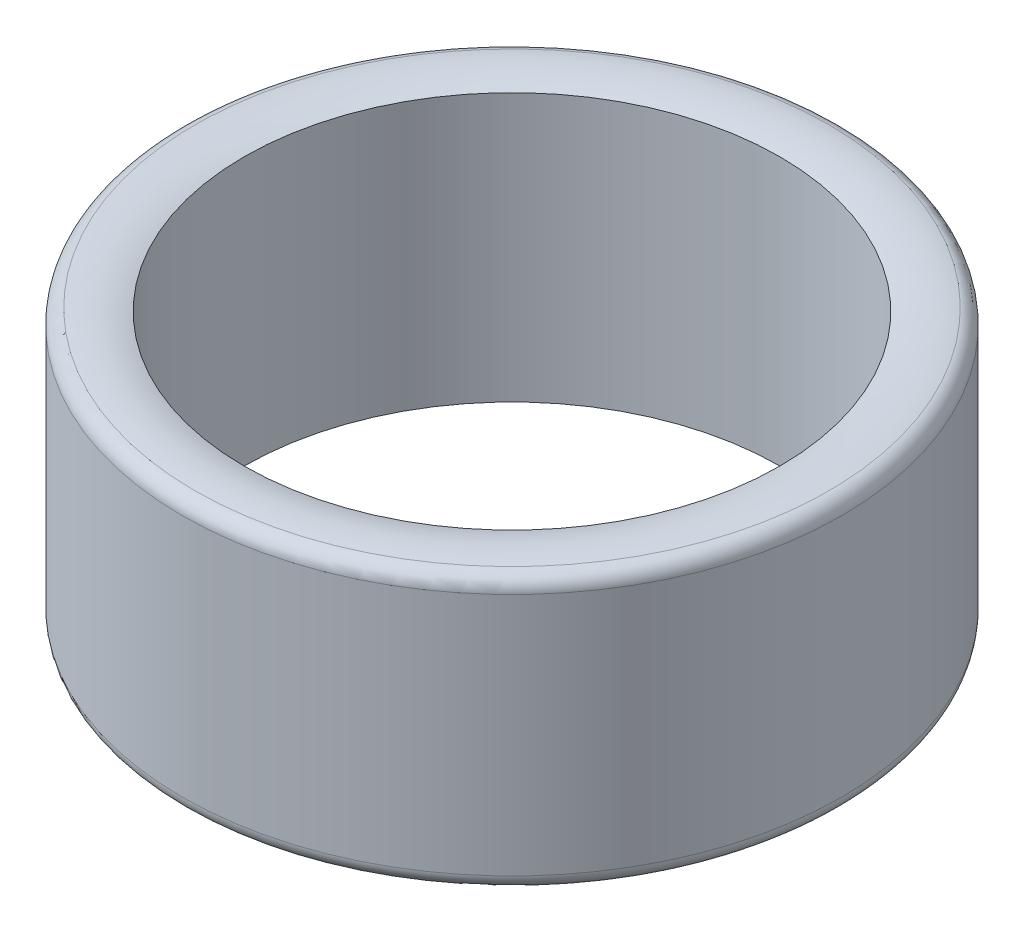
from build123d import *

# Parameters (mm, degrees)
SKETCH_1_R      = 32
SKETCH_1_R_2    = 26
EXTRUDE_1_DEPTH = 13
FILLET_1_R      = 1.5


with BuildPart() as part:
    # 草图1 → 凸台-拉伸1 (new, symmetric)
    with BuildSketch(Plane(origin=(0, 0, 0), x_dir=(1, 0, 0), z_dir=(0, 1, 0))):
        with Locations(Location((0, 0, 0), (0, 0, 90))):
            Circle(SKETCH_1_R)
        with Locations(Location((0, 0, 0), (0, 0, 90))):
            Circle(SKETCH_1_R_2, mode=Mode.SUBTRACT)
    extrude(amount=EXTRUDE_1_DEPTH, both=True)

    # 草图2 → 旋转1 (revolve)
    with BuildSketch(Plane.XY, mode=Mode.PRIVATE) as revolve_1_sk:
        with BuildLine():
            Line((-32, 13), (-26, 13))
            ThreePointArc((-26, 13), (-29, 13.460607986), (-32, 13))
        make_face()
    revolve_1 = revolve(revolve_1_sk.sketch.rotate(Axis((0, 0, 0), (0, 1, 0)), 270), axis=Axis((0, 0, 0), (0, 1, 0)))

    # 镜向1: 旋转1 across plane
    add(revolve_1.mirror(Plane.ZX))

    # 圆角1
    fillet_1_edges = [part.edges().sort_by_distance(p)[0] for p in [
        (0, -13, 32),
        (0, 13, 32),
    ]]
    fillet(fillet_1_edges, radius=FILLET_1_R)


solid = part.part
